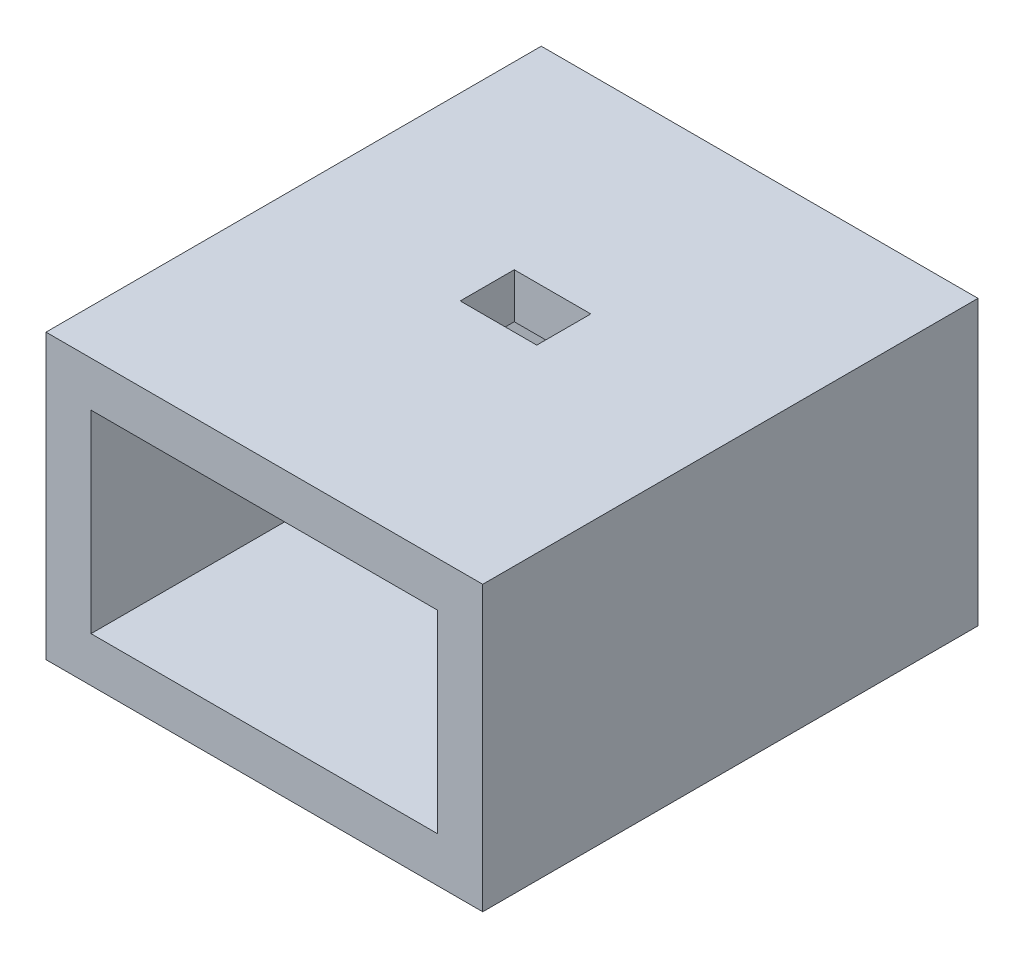
from build123d import *

# Parameters (mm, degrees)
ESBO_O1_W                = 9.7
ESBO_O1_H                = 6.3
RESSALTO_EXTRUS_O1_DEPTH = 11
ESBO_O5_W                = 7.7
ESBO_O5_H                = 4.3
CORTE_EXTRUS_O1_DEPTH    = 9
ESBO_O6_W                = 1.7
ESBO_O6_H                = 1.2
CORTE_EXTRUS_O2_DEPTH    = 2


with BuildPart() as part:
    # Esboço1 → Ressalto-extrusão1 (new body)
    with BuildSketch(Plane.XY):
        with Locations((0, 1.1)):
            Rectangle(ESBO_O1_W, ESBO_O1_H)
    extrude(amount=RESSALTO_EXTRUS_O1_DEPTH)

    # Esboço5 → Corte-extrusão1 (cut)
    with BuildSketch(Plane.XY.offset(11)):
        with Locations((0, 1.1)):
            Rectangle(ESBO_O5_W, ESBO_O5_H)
    extrude(amount=-CORTE_EXTRUS_O1_DEPTH, mode=Mode.SUBTRACT)

    # Esboço6 → Corte-extrusão2 (cut)
    with BuildSketch(Plane(origin=(0, 4.25, 0), x_dir=(1, 0, 0), z_dir=(0, 1, 0))):
        with Locations((0, -5.2)):
            Rectangle(ESBO_O6_W, ESBO_O6_H)
    extrude(amount=-CORTE_EXTRUS_O2_DEPTH, mode=Mode.SUBTRACT)


solid = part.part
